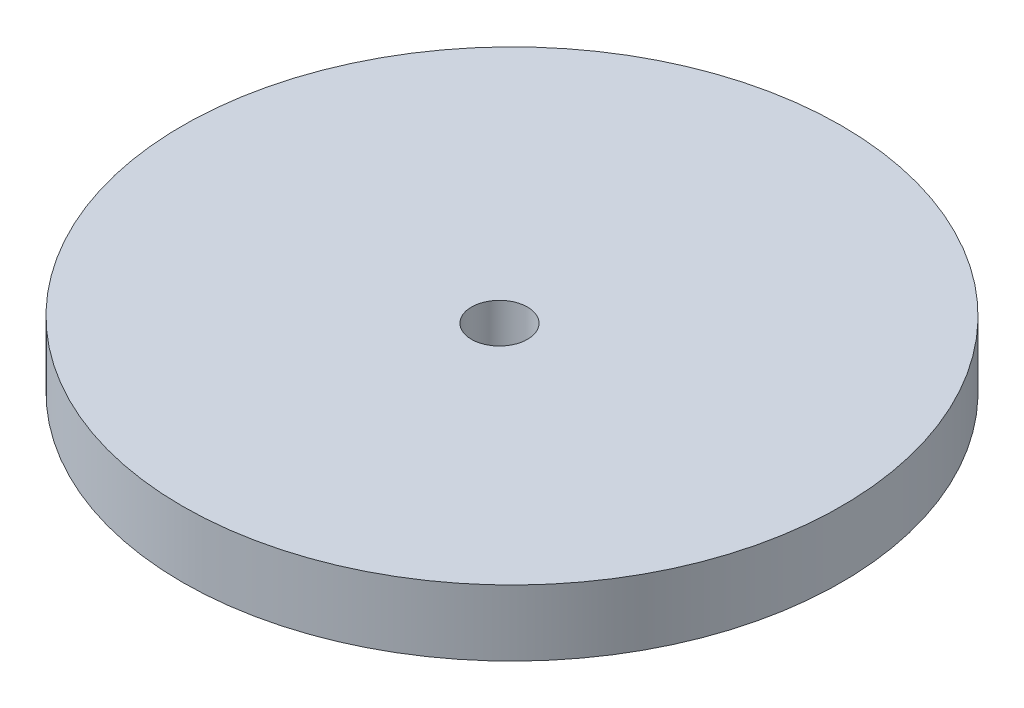
from build123d import *

# Parameters (mm, degrees)
SKETCH1_R           = 100
SKETCH1_R_2         = 8.5
BOSS_EXTRUDE1_DEPTH = 20


with BuildPart() as part:
    # Sketch1 → Boss-Extrude1 (new body)
    with BuildSketch(Plane(origin=(0, 0, 0), x_dir=(1, 0, 0), z_dir=(0, 1, 0))):
        with Locations(Location((0, 0, 0), (0, 0, 270))):
            Circle(SKETCH1_R)
        with Locations(Location((0, -3.802175584, 0), (0, 0, 270))):
            Circle(SKETCH1_R_2, mode=Mode.SUBTRACT)
    extrude(amount=BOSS_EXTRUDE1_DEPTH)


solid = part.part
